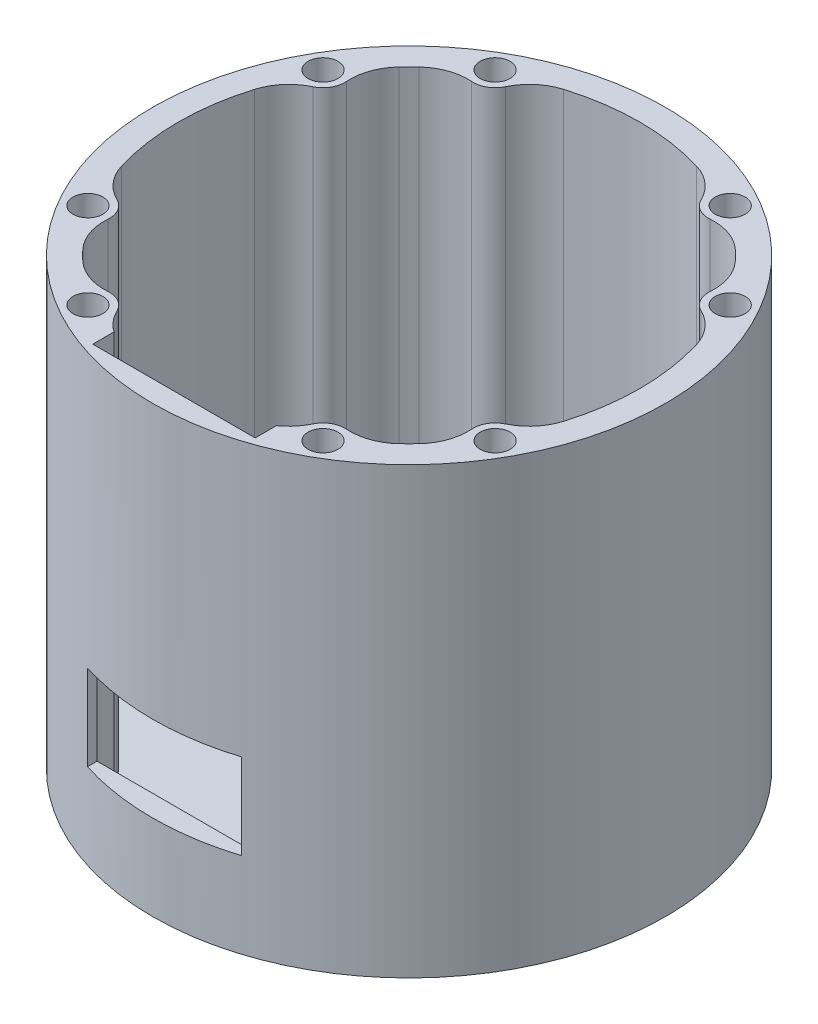
from build123d import *

# Parameters (mm, degrees)
SKETCH1_R               = 30
BOSS_EXTRUDE1_DEPTH     = 52
CUT_EXTRUDE1_DEPTH      = 47
FILLET1_R               = 6
SKETCH4_W               = 19
SKETCH4_H               = 3
CUT_EXTRUDE3_DEPTH      = 45
SKETCH6_R               = 1.75
CUT_EXTRUDE4_DEPTH      = 5.5
CUT_EXTRUDE5_REACH      = 69.112
CUT_EXTRUDE5_END_RADIUS = 30
SKETCH7_W               = 18
SKETCH7_H               = 10


with BuildPart() as part:
    # Sketch1 → Boss-Extrude1 (new body)
    with BuildSketch(Plane(origin=(0, 0, 0), x_dir=(1, 0, 0), z_dir=(0, 1, 0))):
        with Locations(Location((0, 0, 0), (0, 0, 90))):
            Circle(SKETCH1_R)
    extrude(amount=BOSS_EXTRUDE1_DEPTH)

    # Sketch2 → Cut-Extrude1 (cut)
    with BuildSketch(Plane(origin=(0, 52, 0), x_dir=(1, 0, 0), z_dir=(0, 1, 0))):
        with BuildLine():
            ThreePointArc((-15.586619137, 22.046707325), (-19.091883092, 19.091883092), (-22.046707325, 15.586619137))
            ThreePointArc((-22.046707325, 15.586619137), (-21.607333824, 12.475), (-24.521761794, 11.299699045))
            ThreePointArc((-24.521761794, 11.299699045), (-27, 0), (-24.521761794, -11.299699045))
            ThreePointArc((-24.521761794, -11.299699045), (-21.607333824, -12.475), (-22.046707325, -15.586619137))
            ThreePointArc((-22.046707325, -15.586619137), (-19.091883092, -19.091883092), (-15.586619137, -22.046707325))
            ThreePointArc((-15.586619137, -22.046707325), (-12.475, -21.607333824), (-11.299699045, -24.521761794))
            ThreePointArc((-11.299699045, -24.521761794), (0, -27), (11.299699045, -24.521761794))
            ThreePointArc((11.299699045, -24.521761794), (12.475, -21.607333824), (15.586619137, -22.046707325))
            ThreePointArc((15.586619137, -22.046707325), (19.091883092, -19.091883092), (22.046707325, -15.586619137))
            ThreePointArc((22.046707325, -15.586619137), (21.607333824, -12.475), (24.521761794, -11.299699045))
            ThreePointArc((24.521761794, -11.299699045), (27, 0), (24.521761794, 11.299699045))
            ThreePointArc((24.521761794, 11.299699045), (21.607333824, 12.475), (22.046707325, 15.586619137))
            ThreePointArc((22.046707325, 15.586619137), (19.091883092, 19.091883092), (15.586619137, 22.046707325))
            ThreePointArc((15.586619137, 22.046707325), (12.475, 21.607333824), (11.299699045, 24.521761794))
            ThreePointArc((11.299699045, 24.521761794), (0, 27), (-11.299699045, 24.521761794))
            ThreePointArc((-11.299699045, 24.521761794), (-12.475, 21.607333824), (-15.586619137, 22.046707325))
        make_face()
    extrude(amount=-CUT_EXTRUDE1_DEPTH, mode=Mode.SUBTRACT)

    # Fillet1
    fillet1_edges = [part.edges().sort_by_distance(p)[0] for p in [
        (-24.521761794, 28.5, 11.299699045),
        (-24.521761794, 28.5, -11.299699045),
        (-22.046707325, 28.5, -15.586619137),
        (-15.586619137, 28.5, -22.046707325),
        (-11.299699045, 28.5, -24.521761794),
        (11.299699045, 28.5, -24.521761794),
        (15.586619137, 28.5, -22.046707325),
        (22.046707325, 28.5, -15.586619137),
        (24.521761794, 28.5, -11.299699045),
        (24.521761794, 28.5, 11.299699045),
        (22.046707325, 28.5, 15.586619137),
        (15.586619137, 28.5, 22.046707325),
        (11.299699045, 28.5, 24.521761794),
        (-11.299699045, 28.5, 24.521761794),
        (-15.586619137, 28.5, 22.046707325),
        (-22.046707325, 28.5, 15.586619137),
    ]]
    fillet(fillet1_edges, radius=FILLET1_R)

    # Sketch4 → Cut-Extrude3 (cut)
    with BuildSketch(Plane(origin=(0, 52, 0), x_dir=(1, 0, 0), z_dir=(0, 1, 0))):
        with Locations((0, -26)):
            Rectangle(SKETCH4_W, SKETCH4_H)
    extrude(amount=-CUT_EXTRUDE3_DEPTH, mode=Mode.SUBTRACT)

    # Sketch6 → Cut-Extrude4 (cut)
    with BuildSketch(Plane(origin=(0, 52, 0), x_dir=(1, 0, 0), z_dir=(0, 1, 0))):
        with Locations(Location((-13.75, 23.815698604, 0), (0, 0, 270))):
            Circle(SKETCH6_R)
        with Locations(Location((-23.815698604, 13.75, 0), (0, 0, 270))):
            Circle(SKETCH6_R)
        with Locations(Location((-23.815698604, -13.75, 0), (0, 0, 270))):
            Circle(SKETCH6_R)
        with Locations(Location((-13.75, -23.815698604, 0), (0, 0, 270))):
            Circle(SKETCH6_R)
        with Locations(Location((13.75, -23.815698604, 0), (0, 0, 270))):
            Circle(SKETCH6_R)
        with Locations(Location((23.815698604, -13.75, 0), (0, 0, 270))):
            Circle(SKETCH6_R)
        with Locations(Location((23.815698604, 13.75, 0), (0, 0, 270))):
            Circle(SKETCH6_R)
        with Locations(Location((13.75, 23.815698604, 0), (0, 0, 270))):
            Circle(SKETCH6_R)
    extrude(amount=-CUT_EXTRUDE4_DEPTH, mode=Mode.SUBTRACT)

    # Cut-Extrude5: up to this cylinder (the profile starts inside it)
    cut_extrude5_end = Plane(origin=(0, 15, 0), z_dir=(0, -1, 0)) * Cylinder(CUT_EXTRUDE5_END_RADIUS, 199.224, mode=Mode.PRIVATE)
    # Sketch7 → Cut-Extrude5 (cut, up to the surface)
    with BuildSketch(Plane.XY, mode=Mode.PRIVATE) as cut_extrude5_sk1:
        with Locations((0, 15)):
            Rectangle(SKETCH7_W, SKETCH7_H)
    cut_extrude5_tool1 = extrude(cut_extrude5_sk1.sketch, amount=CUT_EXTRUDE5_REACH, mode=Mode.PRIVATE) & cut_extrude5_end
    add(cut_extrude5_tool1.solids().sort_by_distance((0, 15, 0))[0], mode=Mode.SUBTRACT)


solid = part.part
